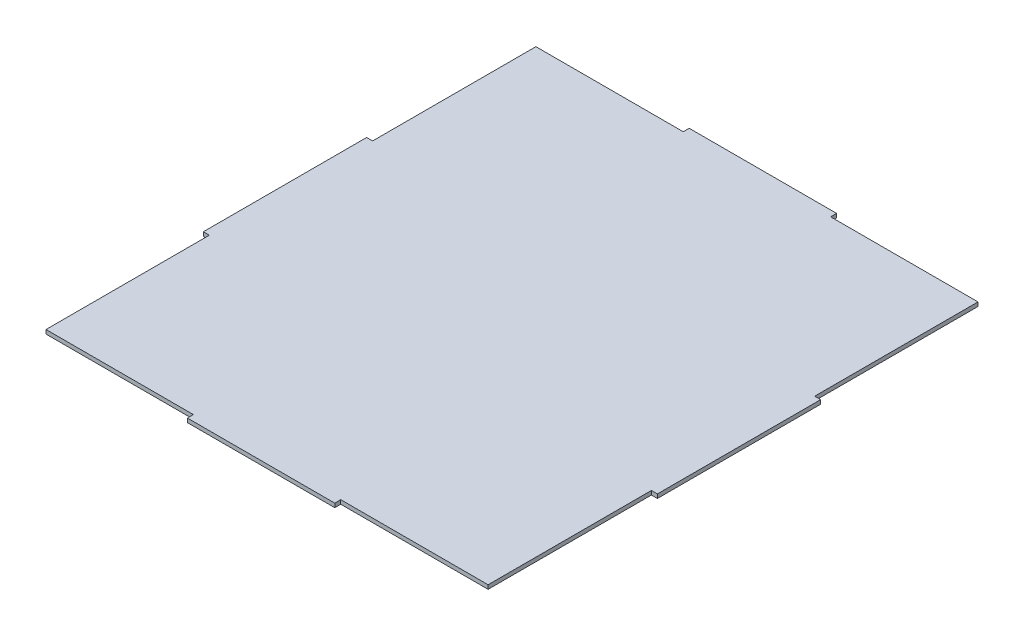
from build123d import *

# Parameters (mm, degrees)
BOSS_EXTRUDE1_DEPTH = 2


with BuildPart() as part:
    # Sketch1 → Boss-Extrude1 (new body)
    with BuildSketch(Plane(origin=(0, 0, 0), x_dir=(1, 0, 0), z_dir=(0, 1, 0))):
        Polygon((37, 123), (111, 123), (111, 41), (114, 41), (114, -41), (111, -41), (111, -123), (37, -123), (37, -126), (-37, -126), (-37, -123), (-111, -123), (-111, -41), (-114, -41), (-114, 41), (-111, 41), (-111, 123), (-37, 123), (-37, 126), (37, 126), align=None)
    extrude(amount=BOSS_EXTRUDE1_DEPTH)


solid = part.part
